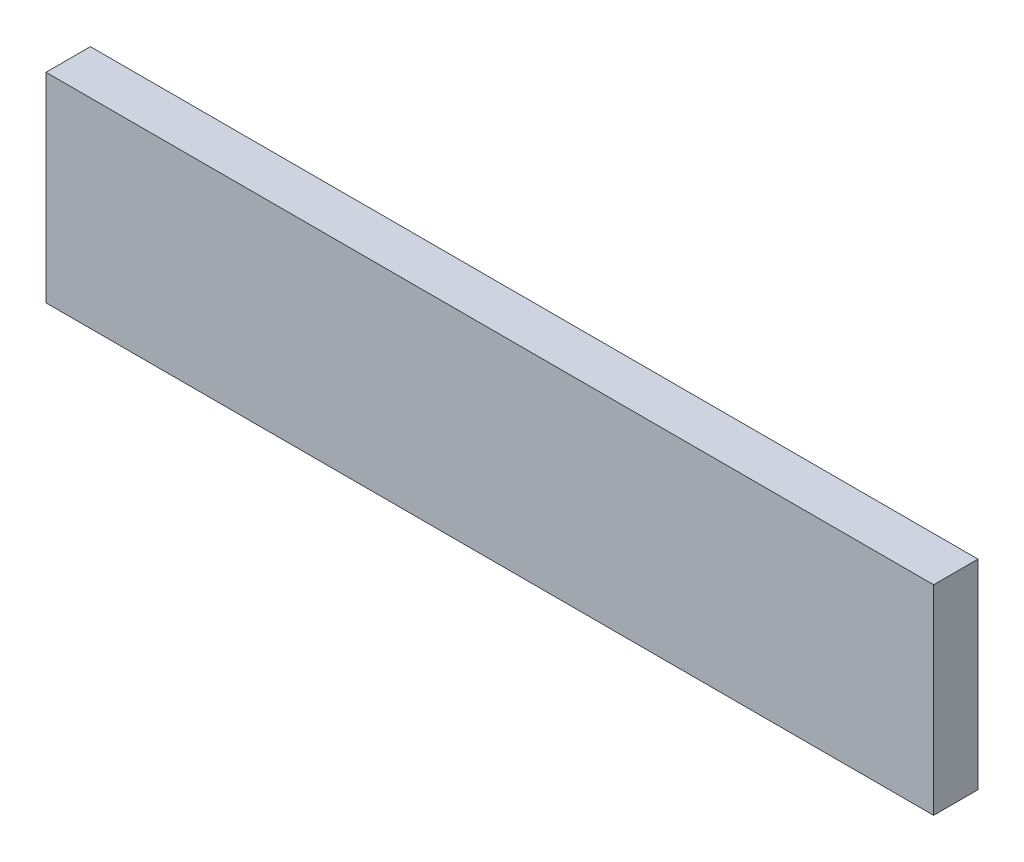
from build123d import *

# Parameters (mm, degrees)
ESQUISSE1_W        = 400
ESQUISSE1_H        = 90
BOSS_EXTRU_1_DEPTH = 20


with BuildPart() as part:
    # Esquisse1 → Boss.-Extru.1 (new body)
    with BuildSketch(Plane.XY):
        with Locations((76.378879379, -10.20015202)):
            Rectangle(ESQUISSE1_W, ESQUISSE1_H)
    extrude(amount=BOSS_EXTRU_1_DEPTH)


solid = part.part
